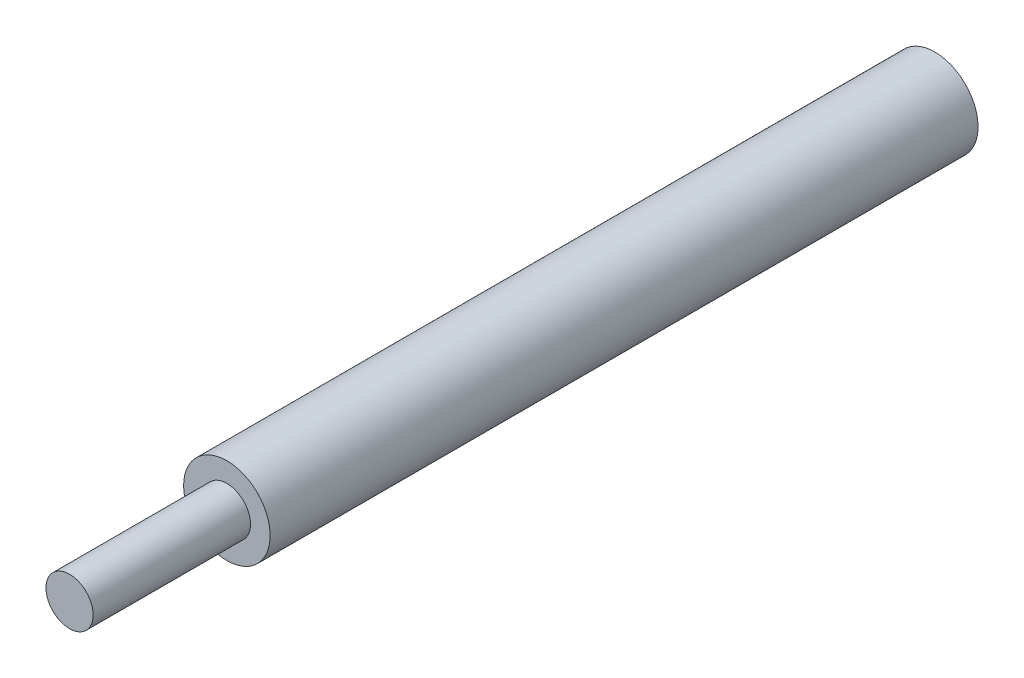
from build123d import *

# Parameters (mm, degrees)
ESBO_O2_R                     = 11
RESSALTO_EXTRUS_O1_DEPTH      = 180
ESBO_O11_R                    = 6
RESSALTO_EXTRUS_O4_DEPTH      = 41
CORTE_EXTRUS_O1_START         = -1
ESBO_O15_R                    = 6
CORTE_EXTRUS_O1_DEPTH         = 1
FURO_ROSCADO_DE_M8X1_01_D     = 7
FURO_ROSCADO_DE_M8X1_01_DEPTH = 35
FURO_ROSCADO_DE_M8X1_01_TIP   = 2.103012167


with BuildPart() as part:
    # Esboço2 → Ressalto-extrusão1 (new body)
    with BuildSketch(Plane.XY):
        with Locations(Location((0, 0, 0), (0, 0, 180))):
            Circle(ESBO_O2_R)
    extrude(amount=RESSALTO_EXTRUS_O1_DEPTH)

    # Esboço11 → Ressalto-extrusão4 (add)
    with BuildSketch(Plane.XY.offset(180)):
        Circle(ESBO_O11_R)
    extrude(amount=RESSALTO_EXTRUS_O4_DEPTH)

    # Esboço15 → Corte-extrusão1 (cut)
    with BuildSketch(Plane.XY.offset(221).offset(CORTE_EXTRUS_O1_START)):
        Circle(ESBO_O15_R)
    extrude(amount=CORTE_EXTRUS_O1_DEPTH, mode=Mode.SUBTRACT)

    # Furo roscado de M8x1.01
    with Locations(Plane(origin=(0, 0, 0), x_dir=(-1, 0, 0), z_dir=(0, 0, -1))):
        with Locations((0, 0)):
            Hole(FURO_ROSCADO_DE_M8X1_01_D / 2, depth=FURO_ROSCADO_DE_M8X1_01_DEPTH)
            with Locations((0, 0, -(FURO_ROSCADO_DE_M8X1_01_DEPTH + FURO_ROSCADO_DE_M8X1_01_TIP / 2))):  # 118° drill point
                Cone(0, FURO_ROSCADO_DE_M8X1_01_D / 2, FURO_ROSCADO_DE_M8X1_01_TIP, mode=Mode.SUBTRACT)


solid = part.part
